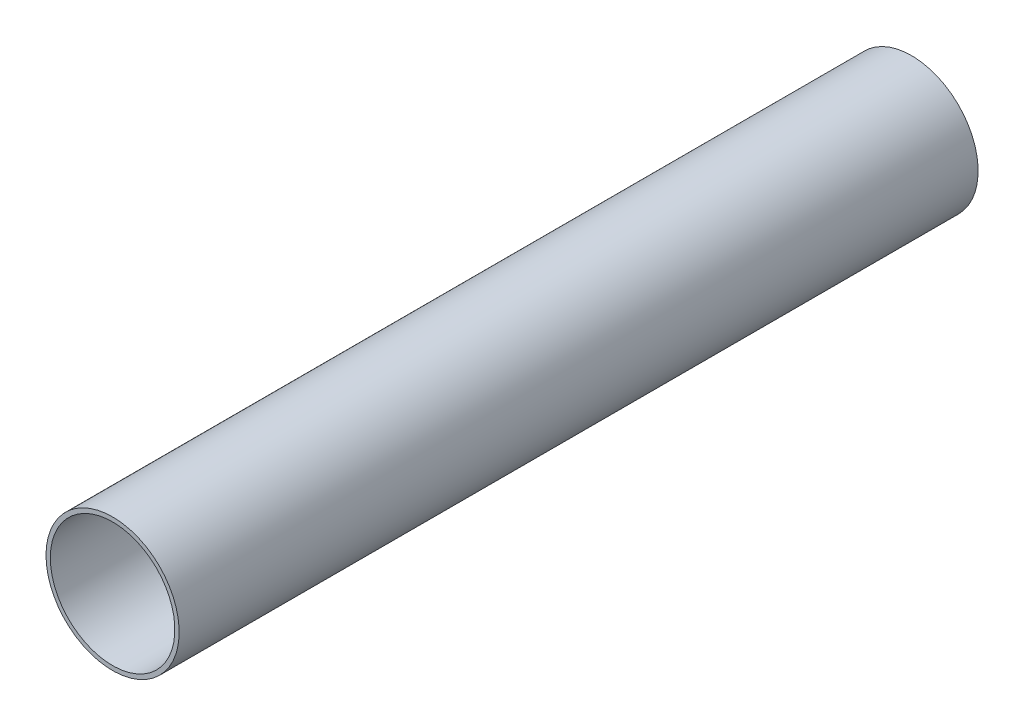
from build123d import *

# Parameters (mm, degrees)
SKETCH3_R           = 25.4
SKETCH3_R_2         = 23.749
BOSS_EXTRUDE1_DEPTH = 152.4


with BuildPart() as part:
    # Sketch3 → Boss-Extrude1 (new, symmetric)
    with BuildSketch(Plane.XY):
        with Locations(Location((0, 0, 0), (0, 0, 180))):
            Circle(SKETCH3_R)
        with Locations(Location((0, 0, 0), (0, 0, 180))):
            Circle(SKETCH3_R_2, mode=Mode.SUBTRACT)
    extrude(amount=BOSS_EXTRUDE1_DEPTH, both=True)


solid = part.part
